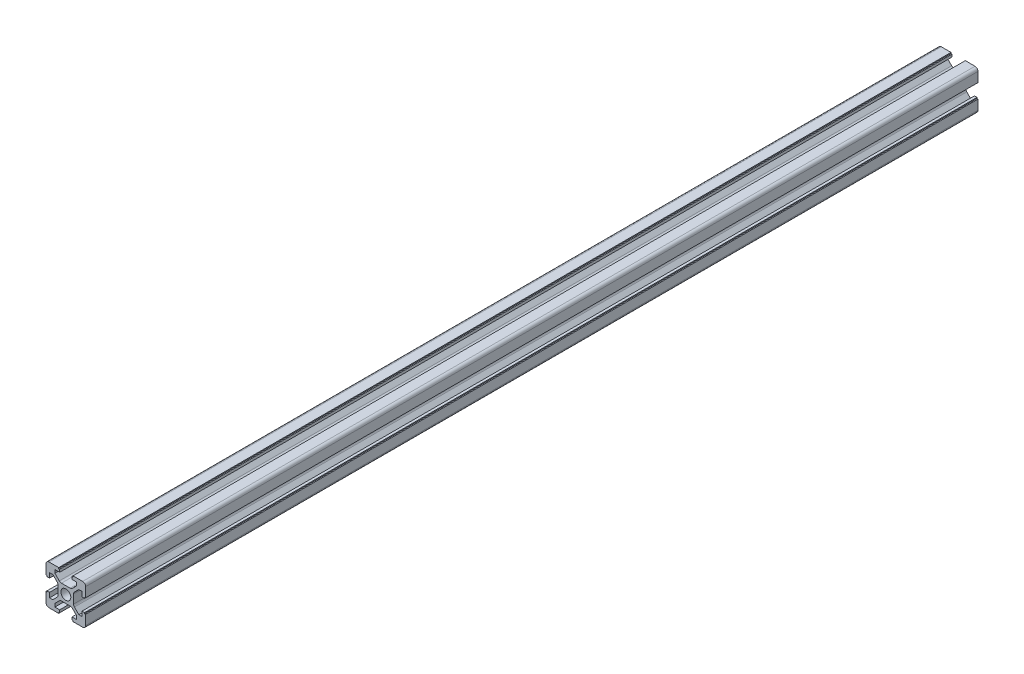
from build123d import *

# Parameters (mm, degrees)
SKETCH_1_R          = 2.5
EXTRUDE_1_DEPTH     = 225
SKETCH_2_R          = 1.6
CUT_EXTRUDE_1_DEPTH = 227.108381092


with BuildPart() as part:
    # 草图1 → 凸台-拉伸1 (new, symmetric)
    with BuildSketch(Plane.XY):
        with BuildLine():
            Line((-6.560660172, 5.5), (-4.339339828, 3.278679656))
            ThreePointArc((-4.339339828, 3.278679656), (-4.014180701, 2.792044633), (-3.9, 2.218019485))
            Line((-3.9, 2.218019485), (-3.9, -2.218019485))
            ThreePointArc((-3.9, -2.218019485), (-4.014180701, -2.792044633), (-4.339339828, -3.278679656))
            Line((-4.339339828, -3.278679656), (-6.560660172, -5.5))
            Line((-6.560660172, -5.5), (-8.2, -5.5))
            Line((-8.2, -5.5), (-8.2, -3.1))
            Line((-8.2, -3.1), (-9.5, -3.1))
            Line((-9.5, -3.1), (-9.5, -3.6))
            Line((-9.5, -3.6), (-10, -3.6))
            Line((-10, -3.6), (-10, -8.5))
            ThreePointArc((-10, -8.5), (-9.560660172, -9.560660172), (-8.5, -10))
            Line((-8.5, -10), (-3.6, -10))
            Line((-3.6, -10), (-3.6, -9.5))
            Line((-3.6, -9.5), (-3.1, -9.5))
            Line((-3.1, -9.5), (-3.1, -8.2))
            Line((-3.1, -8.2), (-5.5, -8.2))
            Line((-5.5, -8.2), (-5.5, -6.560660172))
            Line((-5.5, -6.560660172), (-3.278679656, -4.339339828))
            ThreePointArc((-3.278679656, -4.339339828), (-2.792044633, -4.014180701), (-2.218019485, -3.9))
            Line((-2.218019485, -3.9), (2.218019485, -3.9))
            ThreePointArc((2.218019485, -3.9), (2.792044633, -4.014180701), (3.278679656, -4.339339828))
            Line((3.278679656, -4.339339828), (5.5, -6.560660172))
            Line((5.5, -6.560660172), (5.5, -8.2))
            Line((5.5, -8.2), (3.1, -8.2))
            Line((3.1, -8.2), (3.1, -9.5))
            Line((3.1, -9.5), (3.6, -9.5))
            Line((3.6, -9.5), (3.6, -10))
            Line((3.6, -10), (8.5, -10))
            ThreePointArc((8.5, -10), (9.560660172, -9.560660172), (10, -8.5))
            Line((10, -8.5), (10, -3.6))
            Line((10, -3.6), (9.5, -3.6))
            Line((9.5, -3.6), (9.5, -3.1))
            Line((9.5, -3.1), (8.2, -3.1))
            Line((8.2, -3.1), (8.2, -5.5))
            Line((8.2, -5.5), (6.560660172, -5.5))
            Line((6.560660172, -5.5), (4.339339828, -3.278679656))
            ThreePointArc((4.339339828, -3.278679656), (4.014180701, -2.792044633), (3.9, -2.218019485))
            Line((3.9, -2.218019485), (3.9, 2.218019485))
            ThreePointArc((3.9, 2.218019485), (4.014180701, 2.792044633), (4.339339828, 3.278679656))
            Line((4.339339828, 3.278679656), (6.560660172, 5.5))
            Line((6.560660172, 5.5), (8.2, 5.5))
            Line((8.2, 5.5), (8.2, 3.1))
            Line((8.2, 3.1), (9.5, 3.1))
            Line((9.5, 3.1), (9.5, 3.6))
            Line((9.5, 3.6), (10, 3.6))
            Line((10, 3.6), (10, 8.5))
            ThreePointArc((10, 8.5), (9.560660172, 9.560660172), (8.5, 10))
            Line((8.5, 10), (3.6, 10))
            Line((3.6, 10), (3.6, 9.5))
            Line((3.6, 9.5), (3.1, 9.5))
            Line((3.1, 9.5), (3.1, 8.2))
            Line((3.1, 8.2), (5.5, 8.2))
            Line((5.5, 8.2), (5.5, 6.560660172))
            Line((5.5, 6.560660172), (3.278679656, 4.339339828))
            ThreePointArc((3.278679656, 4.339339828), (2.792044633, 4.014180701), (2.218019485, 3.9))
            Line((2.218019485, 3.9), (-2.218019485, 3.9))
            ThreePointArc((-2.218019485, 3.9), (-2.792044633, 4.014180701), (-3.278679656, 4.339339828))
            Line((-3.278679656, 4.339339828), (-5.5, 6.560660172))
            Line((-5.5, 6.560660172), (-5.5, 8.2))
            Line((-5.5, 8.2), (-3.1, 8.2))
            Line((-3.1, 8.2), (-3.1, 9.5))
            Line((-3.1, 9.5), (-3.6, 9.5))
            Line((-3.6, 9.5), (-3.6, 10))
            Line((-3.6, 10), (-8.5, 10))
            ThreePointArc((-8.5, 10), (-9.560660172, 9.560660172), (-10, 8.5))
            Line((-10, 8.5), (-10, 3.6))
            Line((-10, 3.6), (-9.5, 3.6))
            Line((-9.5, 3.6), (-9.5, 3.1))
            Line((-9.5, 3.1), (-8.2, 3.1))
            Line((-8.2, 3.1), (-8.2, 5.5))
            Line((-8.2, 5.5), (-6.560660172, 5.5))
        make_face()
        Circle(SKETCH_1_R, mode=Mode.SUBTRACT)
    extrude(amount=EXTRUDE_1_DEPTH, both=True)

    # 草图2 → 切除-拉伸1 (cut, through all)
    with BuildSketch(Plane(origin=(0, 10, 0), x_dir=(1, 0, 0), z_dir=(0, 1, 0))):
        with Locations(Location((0, 215, 0), (0, 0, 180))):
            Circle(SKETCH_2_R)
        with Locations(Location((0, 195, 0), (0, 0, 180))):
            Circle(SKETCH_2_R)
        with Locations(Location((0, 175, 0), (0, 0, 180))):
            Circle(SKETCH_2_R)
    extrude(amount=-CUT_EXTRUDE_1_DEPTH, mode=Mode.SUBTRACT)


solid = part.part
